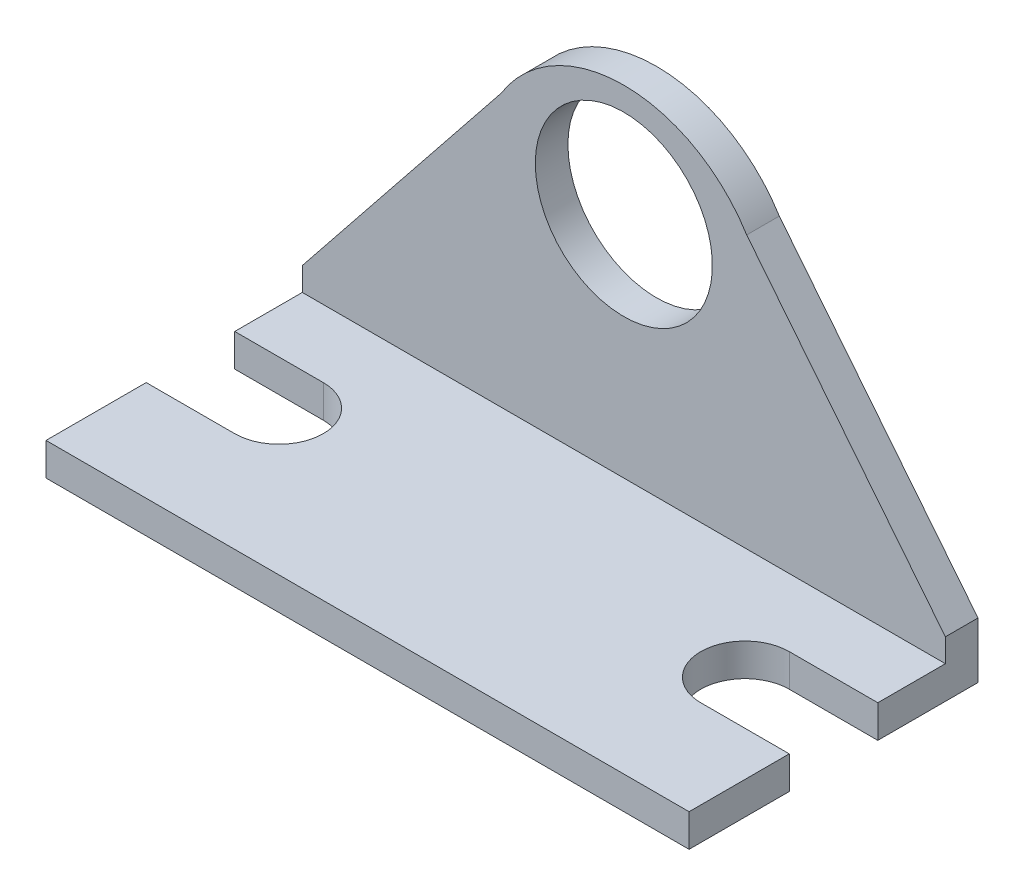
from build123d import *

# Parameters (mm, degrees)
BOSS_EXTRUDE1_DEPTH = 1.778
SKETCH3_R           = 4.826
BOSS_EXTRUDE2_DEPTH = 1.778


with BuildPart() as part:
    # Sketch1 → Boss-Extrude1 (new body)
    with BuildSketch(Plane(origin=(0, 0, 0), x_dir=(1, 0, 0), z_dir=(0, 1, 0))):
        with BuildLine():
            Line((-17.526, 2.413), (-12.7, 2.413))
            ThreePointArc((-12.7, 2.413), (-10.993751337, 1.706248663), (-10.287, 0))
            ThreePointArc((-10.287, 0), (-10.993751337, -1.706248663), (-12.7, -2.413))
            Line((-12.7, -2.413), (-17.526, -2.413))
            Line((-17.526, -2.413), (-17.526, -7.874))
            Line((-17.526, -7.874), (17.526, -7.874))
            Line((17.526, -7.874), (17.526, -2.413))
            Line((17.526, -2.413), (12.7, -2.413))
            ThreePointArc((12.7, -2.413), (10.287, 0), (12.7, 2.413))
            Line((12.7, 2.413), (17.526, 2.413))
            Line((17.526, 2.413), (17.526, 7.874))
            Line((17.526, 7.874), (0, 7.874))
            Line((0, 7.874), (-17.526, 7.874))
            Line((-17.526, 7.874), (-17.526, 2.413))
        make_face()
    extrude(amount=BOSS_EXTRUDE1_DEPTH)

    # Sketch3 → Boss-Extrude2 (add)
    with BuildSketch(Plane(origin=(0, 0, -7.874), x_dir=(-1, 0, 0), z_dir=(0, 0, -1))):
        with BuildLine():
            Line((17.526, 3.048), (6.689775541, 16.597652846))
            ThreePointArc((6.689775541, 16.597652846), (-0.001876966, 20.326885902), (-6.696539897, 16.603059817))
            Line((-6.696539897, 16.603059817), (-17.526, 3.048))
            Line((-17.526, 3.048), (-17.526, 1.778))
            Line((-17.526, 1.778), (17.526, 1.778))
            Line((17.526, 1.778), (17.526, 3.048))
        make_face()
        with Locations((0, 14.224)):
            Circle(SKETCH3_R, mode=Mode.SUBTRACT)
    extrude(amount=-BOSS_EXTRUDE2_DEPTH)


solid = part.part
